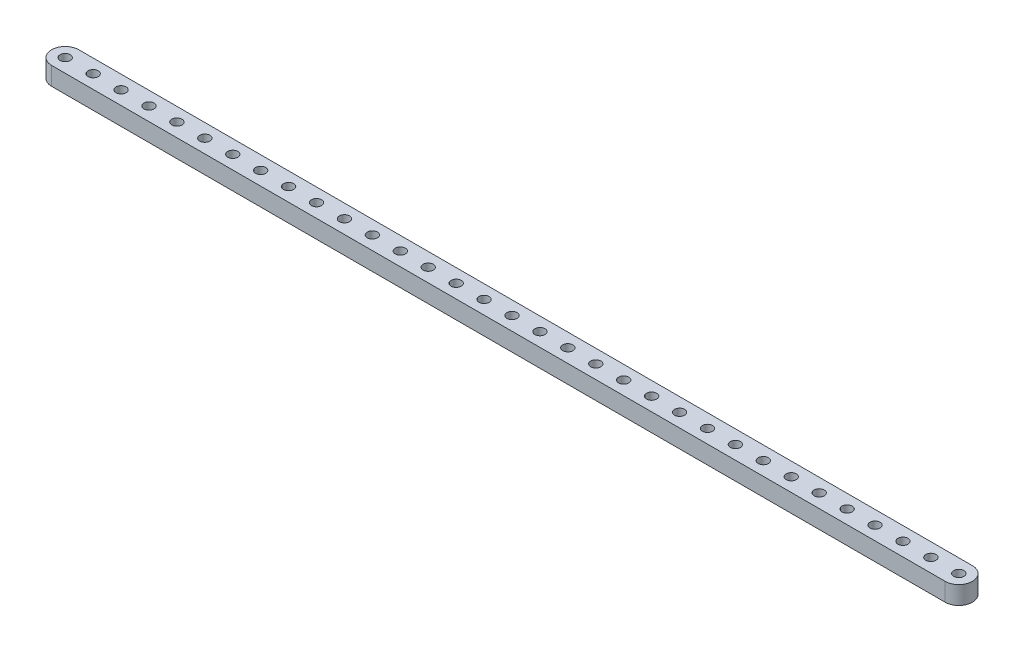
from build123d import *

# Parameters (mm, degrees)
SKETCH1_R           = 1.778
BOSS_EXTRUDE1_DEPTH = 6.35


with BuildPart() as part:
    # Sketch1 → Boss-Extrude1 (new body)
    with BuildSketch(Plane(origin=(0, 6.35, 0), x_dir=(1, 0, 0), z_dir=(0, 1, 0))):
        with BuildLine():
            Line((156.464, 4.7625), (-156.464, 4.7625))
            ThreePointArc((-156.464, 4.7625), (-161.2265, 0), (-156.464, -4.7625))
            Line((-156.464, -4.7625), (156.464, -4.7625))
            ThreePointArc((156.464, -4.7625), (161.2265, 0), (156.464, 4.7625))
        make_face()
        with Locations(Location((156.464, 0, 0), (0, 0, 270))):
            Circle(SKETCH1_R, mode=Mode.SUBTRACT)
        with Locations(Location((146.685, 0, 0), (0, 0, 270))):
            Circle(SKETCH1_R, mode=Mode.SUBTRACT)
        with Locations(Location((136.906, 0, 0), (0, 0, 270))):
            Circle(SKETCH1_R, mode=Mode.SUBTRACT)
        with Locations(Location((127.127, 0, 0), (0, 0, 270))):
            Circle(SKETCH1_R, mode=Mode.SUBTRACT)
        with Locations(Location((117.348, 0, 0), (0, 0, 270))):
            Circle(SKETCH1_R, mode=Mode.SUBTRACT)
        with Locations(Location((107.569, 0, 0), (0, 0, 270))):
            Circle(SKETCH1_R, mode=Mode.SUBTRACT)
        with Locations(Location((97.79, 0, 0), (0, 0, 270))):
            Circle(SKETCH1_R, mode=Mode.SUBTRACT)
        with Locations(Location((88.011, 0, 0), (0, 0, 270))):
            Circle(SKETCH1_R, mode=Mode.SUBTRACT)
        with Locations(Location((78.232, 0, 0), (0, 0, 270))):
            Circle(SKETCH1_R, mode=Mode.SUBTRACT)
        with Locations(Location((68.453, 0, 0), (0, 0, 270))):
            Circle(SKETCH1_R, mode=Mode.SUBTRACT)
        with Locations(Location((58.674, 0, 0), (0, 0, 270))):
            Circle(SKETCH1_R, mode=Mode.SUBTRACT)
        with Locations(Location((48.895, 0, 0), (0, 0, 270))):
            Circle(SKETCH1_R, mode=Mode.SUBTRACT)
        with Locations(Location((39.116, 0, 0), (0, 0, 270))):
            Circle(SKETCH1_R, mode=Mode.SUBTRACT)
        with Locations(Location((29.337, 0, 0), (0, 0, 270))):
            Circle(SKETCH1_R, mode=Mode.SUBTRACT)
        with Locations(Location((19.558, 0, 0), (0, 0, 270))):
            Circle(SKETCH1_R, mode=Mode.SUBTRACT)
        with Locations(Location((9.779, 0, 0), (0, 0, 270))):
            Circle(SKETCH1_R, mode=Mode.SUBTRACT)
        with Locations(Location((0, 0, 0), (0, 0, 270))):
            Circle(SKETCH1_R, mode=Mode.SUBTRACT)
        with Locations(Location((-9.779, 0, 0), (0, 0, 270))):
            Circle(SKETCH1_R, mode=Mode.SUBTRACT)
        with Locations(Location((-19.558, 0, 0), (0, 0, 270))):
            Circle(SKETCH1_R, mode=Mode.SUBTRACT)
        with Locations(Location((-29.337, 0, 0), (0, 0, 270))):
            Circle(SKETCH1_R, mode=Mode.SUBTRACT)
        with Locations(Location((-39.116, 0, 0), (0, 0, 270))):
            Circle(SKETCH1_R, mode=Mode.SUBTRACT)
        with Locations(Location((-48.895, 0, 0), (0, 0, 270))):
            Circle(SKETCH1_R, mode=Mode.SUBTRACT)
        with Locations(Location((-58.674, 0, 0), (0, 0, 270))):
            Circle(SKETCH1_R, mode=Mode.SUBTRACT)
        with Locations(Location((-68.453, 0, 0), (0, 0, 270))):
            Circle(SKETCH1_R, mode=Mode.SUBTRACT)
        with Locations(Location((-78.232, 0, 0), (0, 0, 270))):
            Circle(SKETCH1_R, mode=Mode.SUBTRACT)
        with Locations(Location((-88.011, 0, 0), (0, 0, 270))):
            Circle(SKETCH1_R, mode=Mode.SUBTRACT)
        with Locations(Location((-97.79, 0, 0), (0, 0, 270))):
            Circle(SKETCH1_R, mode=Mode.SUBTRACT)
        with Locations(Location((-107.569, 0, 0), (0, 0, 270))):
            Circle(SKETCH1_R, mode=Mode.SUBTRACT)
        with Locations(Location((-117.348, 0, 0), (0, 0, 270))):
            Circle(SKETCH1_R, mode=Mode.SUBTRACT)
        with Locations(Location((-127.127, 0, 0), (0, 0, 270))):
            Circle(SKETCH1_R, mode=Mode.SUBTRACT)
        with Locations(Location((-136.906, 0, 0), (0, 0, 270))):
            Circle(SKETCH1_R, mode=Mode.SUBTRACT)
        with Locations(Location((-146.685, 0, 0), (0, 0, 270))):
            Circle(SKETCH1_R, mode=Mode.SUBTRACT)
        with Locations(Location((-156.464, 0, 0), (0, 0, 270))):
            Circle(SKETCH1_R, mode=Mode.SUBTRACT)
    extrude(amount=-BOSS_EXTRUDE1_DEPTH)


solid = part.part
